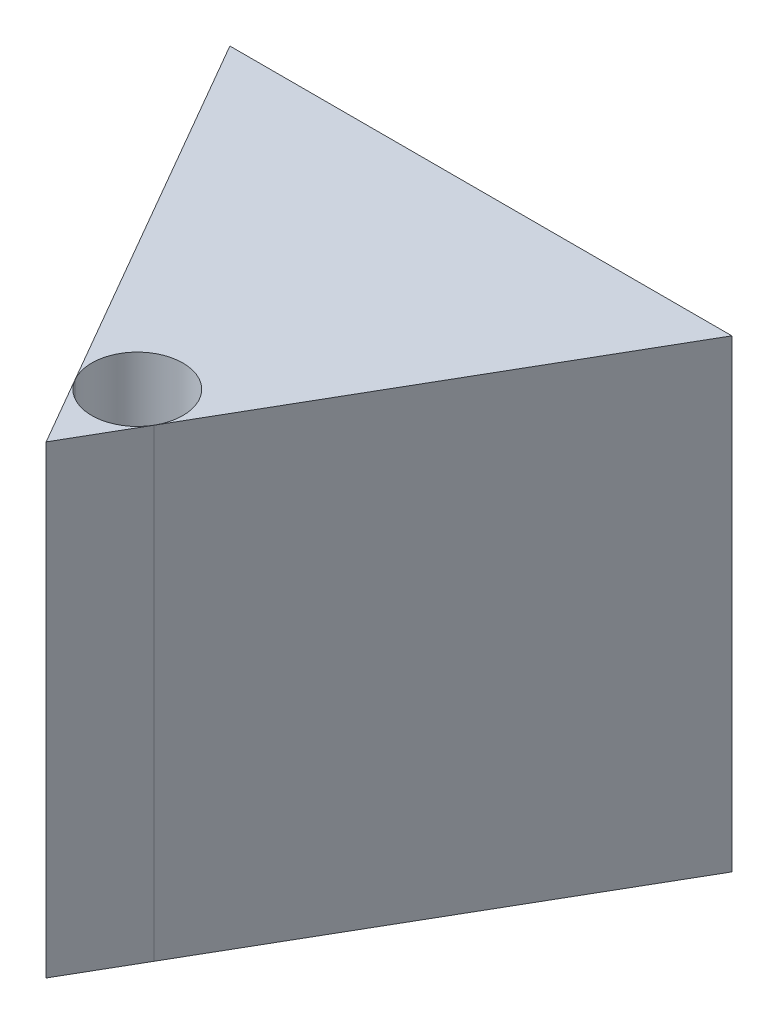
from build123d import *

# Parameters (mm, degrees)
BOSS_EXTRUDE1_DEPTH = 200


with BuildPart() as part:
    # Sketch1 → Boss-Extrude1 (new body)
    with BuildSketch(Plane(origin=(0, 0, 0), x_dir=(1, 0, 0), z_dir=(0, 1, 0))):
        with BuildLine():
            Line((108.1176749, 0), (0, 0))
            Line((0, 0), (0, -128.367346939))
            ThreePointArc((0, -128.367346939), (13.882382112, -134.117617888), (19.632653061, -148))
            ThreePointArc((19.632653061, -148), (18.963686701, -153.081304254), (17.002376569, -157.816326056))
            Line((17.002376569, -157.816326056), (108.1176749, 0))
        make_face()
        with BuildLine():
            Line((0, 0), (-108.1176749, 0))
            Line((-108.1176749, 0), (-17.002376712, -157.816325807))
            ThreePointArc((-17.002376712, -157.816325807), (-17.002376086, -138.183673108), (0, -128.367346939))
            Line((0, -128.367346939), (0, 0))
        make_face()
        with BuildLine():
            ThreePointArc((0, -167.632653061), (-9.816326892, -165.002376086), (-17.002376712, -157.816325807))
            Line((-17.002376712, -157.816325807), (0, -187.265306122))
            Line((0, -187.265306122), (0, -167.632653061))
        make_face()
        with BuildLine():
            Line((0, -167.632653061), (0, -187.265306122))
            Line((0, -187.265306122), (17.002376569, -157.816326056))
            ThreePointArc((17.002376569, -157.816326056), (9.816326768, -165.002376158), (0, -167.632653061))
        make_face()
    extrude(amount=BOSS_EXTRUDE1_DEPTH)


solid = part.part
